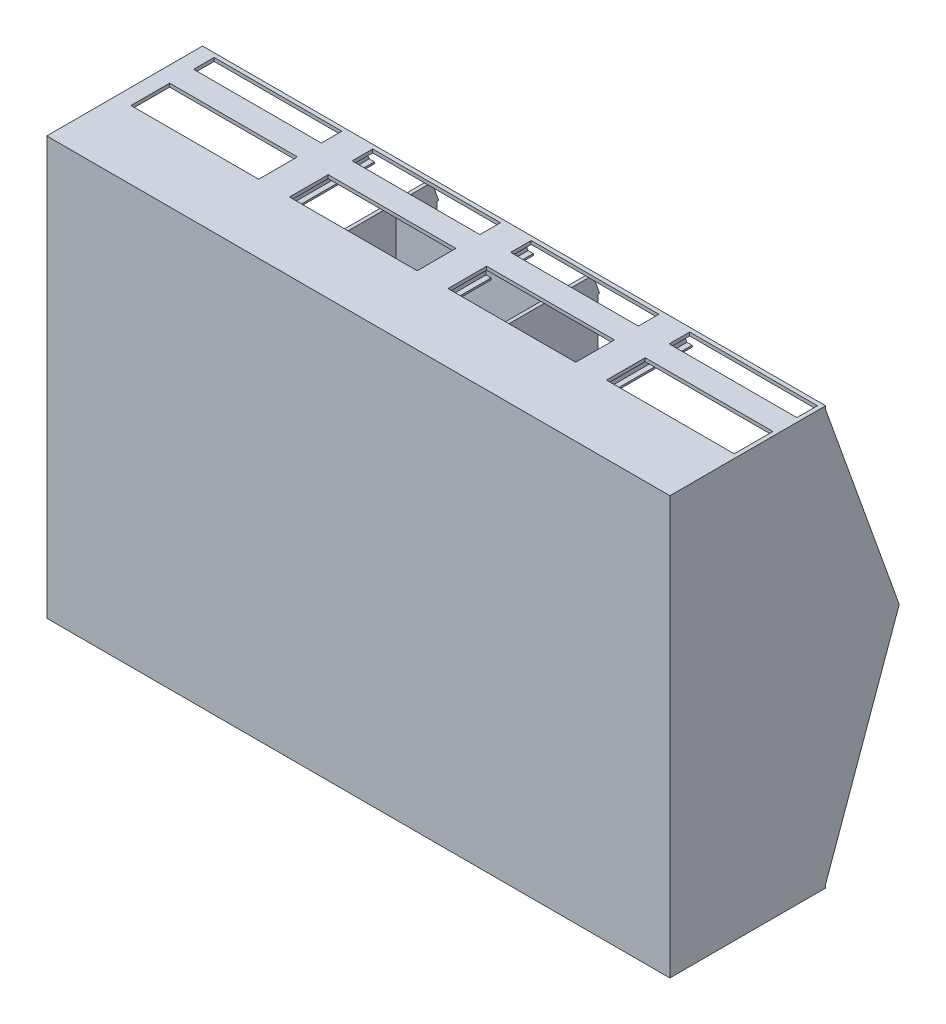
from build123d import *

# Parameters (mm, degrees)
SKETCH_1_W           = 18100
SKETCH_1_H           = 12000
EXTRUDE_1_DEPTH      = 1000
SKETCH_11_W          = 6700
SKETCH_11_H          = 12000
EXTRUDE_7_DEPTH      = 100
SKETCH_12_W          = 18200
SKETCH_12_H          = 4550
EXTRUDE_8_DEPTH      = 100
SKETCH_13_W          = 18200
SKETCH_13_H          = 4550
EXTRUDE_9_DEPTH      = 100
SKETCH_14_W          = 100
SKETCH_14_H          = 12000
EXTRUDE_10_DEPTH     = 5700
EXTRUDE_11_DEPTH     = 5000
CUT_EXTRUDE_7_DEPTH  = 22565.246428131
SKETCH_17_W          = 2000
SKETCH_17_H          = 1880
CUT_EXTRUDE_8_DEPTH  = 100
SKETCH_18_W          = 2000
SKETCH_18_H          = 1880
CUT_EXTRUDE_9_DEPTH  = 100
SKETCH_19_W          = 3730
SKETCH_19_H          = 1130
SKETCH_19_H_2        = 600
CUT_EXTRUDE_10_DEPTH = 100
SKETCH_20_W          = 1865
SKETCH_20_H          = 1130
SKETCH_20_H_2        = 600
SKETCH_20_W_2        = 3730
CUT_EXTRUDE_11_DEPTH = 100
EXTRUDE_12_REACH     = 17483.282
CUT_EXTRUDE_13_REACH = 17678.686


with BuildPart() as part:
    # ｽｹｯﾁ1 → ﾎﾞｽ - 押し出し1 (new body)
    with BuildSketch(Plane.XY):
        with Locations((8982.45501815, 5958.823195876)):
            Rectangle(SKETCH_1_W, SKETCH_1_H)
    extrude(amount=EXTRUDE_1_DEPTH)

    # ｽｹｯﾁ11 → ﾎﾞｽ - 押し出し7 (add)
    with BuildSketch(Plane(origin=(18032.45501815, 0, 0), x_dir=(0, 0, -1), z_dir=(1, 0, 0))):
        with Locations((2350, 5958.823195876)):
            Rectangle(SKETCH_11_W, SKETCH_11_H)
    extrude(amount=EXTRUDE_7_DEPTH)

    # ｽｹｯﾁ12 → ﾎﾞｽ - 押し出し8 (add)
    with BuildSketch(Plane(origin=(0, -41.176804124, 0), x_dir=(-1, 0, 0), z_dir=(0, -1, 0))):
        with Locations((-9032.45501815, 1275)):
            Rectangle(SKETCH_12_W, SKETCH_12_H)
    extrude(amount=EXTRUDE_8_DEPTH)

    # ｽｹｯﾁ13 → ﾎﾞｽ - 押し出し9 (add)
    with BuildSketch(Plane(origin=(0, 11958.823195876, 0), x_dir=(1, 0, 0), z_dir=(0, 1, 0))):
        with Locations((9032.45501815, 1275)):
            Rectangle(SKETCH_13_W, SKETCH_13_H)
    extrude(amount=EXTRUDE_9_DEPTH)

    # ｽｹｯﾁ14 → ﾎﾞｽ - 押し出し10 (add)
    with BuildSketch(Plane(origin=(0, 0, 0), x_dir=(-1, 0, 0), z_dir=(0, 0, -1))):
        with Locations((-6582.45501815, 5958.823195876)):
            Rectangle(SKETCH_14_W, SKETCH_14_H)
        with Locations((-11282.45501815, 5958.823195876)):
            Rectangle(SKETCH_14_W, SKETCH_14_H)
    extrude(amount=EXTRUDE_10_DEPTH)

    # ｽｹｯﾁ16 → ﾎﾞｽ - 押し出し11 (add)
    with BuildSketch(Plane(origin=(0, 0, 0), x_dir=(-1, 0, 0), z_dir=(0, 0, -1))):
        Polygon((-4622.45501815, -41.176804124), (-4522.45501815, -41.176804124), (-4522.45501815, 458.823195876), (-4372.45501815, 458.823195876), (-4372.45501815, 508.823195876), (-4772.45501815, 508.823195876), (-4772.45501815, 458.823195876), (-4622.45501815, 458.823195876), align=None)
        Polygon((-9262.45501815, -41.176804124), (-9162.45501815, -41.176804124), (-9162.45501815, 458.823195876), (-9012.45501815, 458.823195876), (-9012.45501815, 508.823195876), (-9412.45501815, 508.823195876), (-9412.45501815, 458.823195876), (-9262.45501815, 458.823195876), align=None)
        Polygon((-13902.45501815, -41.176804124), (-13802.45501815, -41.176804124), (-13802.45501815, 458.823195876), (-13652.45501815, 458.823195876), (-13652.45501815, 508.823195876), (-14052.45501815, 508.823195876), (-14052.45501815, 458.823195876), (-13902.45501815, 458.823195876), align=None)
        Polygon((-13902.45501815, 11958.823195876), (-13802.45501815, 11958.823195876), (-13802.45501815, 11458.823195876), (-13652.45501815, 11458.823195876), (-13652.45501815, 11408.823195876), (-14052.45501815, 11408.823195876), (-14052.45501815, 11458.823195876), (-13902.45501815, 11458.823195876), align=None)
        Polygon((-9262.45501815, 11958.823195876), (-9162.45501815, 11958.823195876), (-9162.45501815, 11458.823195876), (-9012.45501815, 11458.823195876), (-9012.45501815, 11408.823195876), (-9412.45501815, 11408.823195876), (-9412.45501815, 11458.823195876), (-9262.45501815, 11458.823195876), align=None)
        Polygon((-4622.45501815, 11958.823195876), (-4522.45501815, 11958.823195876), (-4522.45501815, 11458.823195876), (-4372.45501815, 11458.823195876), (-4372.45501815, 11408.823195876), (-4772.45501815, 11408.823195876), (-4772.45501815, 11458.823195876), (-4622.45501815, 11458.823195876), align=None)
    extrude(amount=EXTRUDE_11_DEPTH)

    # ｽｹｯﾁ15 → ｶｯﾄ - 押し出し7 (cut, through all)
    with BuildSketch(Plane(origin=(18132.45501815, 0, 0), x_dir=(0, 0, -1), z_dir=(1, 0, 0))):
        Polygon((5700, -41.176804124), (5700, 5958.823195876), (3550, -41.176804124), align=None)
        Polygon((5700, 5958.823195876), (5700, 11958.823195876), (3550, 11958.823195876), align=None)
    extrude(amount=-CUT_EXTRUDE_7_DEPTH, mode=Mode.SUBTRACT)

    # ｽｹｯﾁ17 → ｶｯﾄ - 押し出し8 (cut)
    with BuildSketch(Plane.ZY.offset(-6532.45501815)):
        with Locations((-1000, 4818.823195876)):
            Rectangle(SKETCH_17_W, SKETCH_17_H)
    extrude(amount=-CUT_EXTRUDE_8_DEPTH, mode=Mode.SUBTRACT)

    # ｽｹｯﾁ18 → ｶｯﾄ - 押し出し9 (cut)
    with BuildSketch(Plane.ZY.offset(-11232.45501815)):
        with Locations((-1000, 3888.823195876)):
            Rectangle(SKETCH_18_W, SKETCH_18_H)
    extrude(amount=-CUT_EXTRUDE_9_DEPTH, mode=Mode.SUBTRACT)

    # ｽｹｯﾁ19 → ｶｯﾄ - 押し出し10 (cut)
    with BuildSketch(Plane(origin=(0, 12058.823195876, 0), x_dir=(1, 0, 0), z_dir=(0, 1, 0))):
        with Locations((2257.45501815, 1565)):
            Rectangle(SKETCH_19_W, SKETCH_19_H)
        with Locations((2257.45501815, 3130)):
            Rectangle(SKETCH_19_W, SKETCH_19_H_2)
        with Locations((6887.45501815, 1565)):
            Rectangle(SKETCH_19_W, SKETCH_19_H)
        with Locations((6887.45501815, 3130)):
            Rectangle(SKETCH_19_W, SKETCH_19_H_2)
        with Locations((11517.45501815, 1565)):
            Rectangle(SKETCH_19_W, SKETCH_19_H)
        with Locations((11517.45501815, 3130)):
            Rectangle(SKETCH_19_W, SKETCH_19_H_2)
        with Locations((16147.45501815, 1565)):
            Rectangle(SKETCH_19_W, SKETCH_19_H)
        with Locations((16147.45501815, 3130)):
            Rectangle(SKETCH_19_W, SKETCH_19_H_2)
    extrude(amount=-CUT_EXTRUDE_10_DEPTH, mode=Mode.SUBTRACT)

    # ｽｹｯﾁ20 → ｶｯﾄ - 押し出し11 (cut)
    with BuildSketch(Plane(origin=(0, -141.176804124, 0), x_dir=(-1, 0, 0), z_dir=(0, -1, 0))):
        with Locations((-1264.95501815, 1565)):
            Rectangle(SKETCH_20_W, SKETCH_20_H)
        with Locations((-1264.95501815, 3130)):
            Rectangle(SKETCH_20_W, SKETCH_20_H_2)
        with Locations((-6887.45501815, 1565)):
            Rectangle(SKETCH_20_W_2, SKETCH_20_H)
        with Locations((-6887.45501815, 3130)):
            Rectangle(SKETCH_20_W_2, SKETCH_20_H_2)
        with Locations((-12469.95501815, 1565)):
            Rectangle(SKETCH_20_W, SKETCH_20_H)
        with Locations((-12469.95501815, 3130)):
            Rectangle(SKETCH_20_W, SKETCH_20_H_2)
    extrude(amount=-CUT_EXTRUDE_11_DEPTH, mode=Mode.SUBTRACT)

    # ｽｹｯﾁ21 → ﾎﾞｽ - 押し出し12 (add, up to next)
    with BuildSketch(Plane.ZY.offset(-11232.45501815), mode=Mode.PRIVATE) as extrude_12_sk1:
        Polygon((-5700, 5958.823195876), (-2500, 5958.823195876), (-2500, 11958.823195876), (-2600, 11958.823195876), (-2600, 6058.823195876), (-5664.166666667, 6058.823195876), align=None)
    extrude_12_tool1 = extrude(extrude_12_sk1.sketch, amount=EXTRUDE_12_REACH, mode=Mode.PRIVATE) - part.part
    add(extrude_12_tool1.solids().sort_by_distance((11232.455018, 6026.823196, -4100))[0])

    # ｶｯﾄ - 押し出し13: up to this face of the body (flat: up to its plane)
    cut_extrude_13_end = Plane(part.part.faces().sort_by_distance((11332.45501815, 6109.252264295, -2452.551217627))[0])
    # ｽｹｯﾁ22 → ｶｯﾄ - 押し出し13 (cut, up to the picked face)
    with BuildSketch(Plane.ZY.offset(-6532.45501815), mode=Mode.PRIVATE) as cut_extrude_13_sk1:
        Polygon((-5664.166666667, 6058.823195876), (-3700, 6058.823195876), (-3700, 8458.823195876), (-2700, 8458.823195876), (-2700, 9258.823195876), (-3700, 9258.823195876), (-3700, 11408.823195876), (-3747.083333333, 11408.823195876), align=None)
    cut_extrude_13_tool1 = split(extrude(cut_extrude_13_sk1.sketch, amount=-CUT_EXTRUDE_13_REACH, mode=Mode.PRIVATE), bisect_by=cut_extrude_13_end, keep=Keep.BOTH, mode=Mode.PRIVATE)
    add(cut_extrude_13_tool1.solids().sort_by(Axis((6532.455018, 8010.105511, -4205.565732), (1, 0, 0)))[0], mode=Mode.SUBTRACT)


solid = part.part
